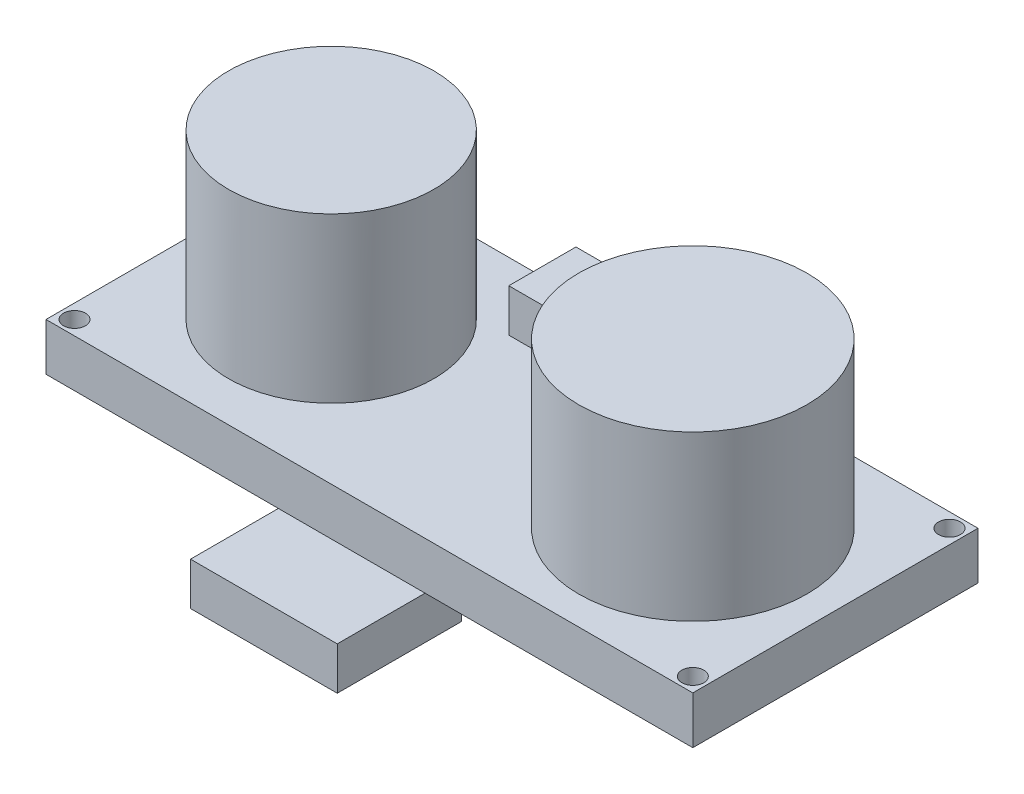
from build123d import *

# Parameters (mm, degrees)
SKETCH1_W           = 45.36
SKETCH1_H           = 20
BOSS_EXTRUDE1_DEPTH = 3.33
SKETCH2_R           = 8
SKETCH2_R_2         = 7.201770051
BOSS_EXTRUDE2_DEPTH = 11.5
SKETCH3_R           = 0.77
CUT_EXTRUDE1_DEPTH  = 11.5
SKETCH4_W           = 11
SKETCH4_H           = 4.71
BOSS_EXTRUDE3_DEPTH = 3
SKETCH5_W           = 10.29
SKETCH5_H           = 8.7
BOSS_EXTRUDE4_DEPTH = 3


with BuildPart() as part:
    # Sketch1 → Boss-Extrude1 (new body)
    with BuildSketch(Plane(origin=(0, 0, 0), x_dir=(1, 0, 0), z_dir=(0, 1, 0))):
        Rectangle(SKETCH1_W, SKETCH1_H)
    extrude(amount=BOSS_EXTRUDE1_DEPTH)

    # Sketch2 → Boss-Extrude2 (add)
    with BuildSketch(Plane(origin=(0, 3.33, 0), x_dir=(1, 0, 0), z_dir=(0, 1, 0))):
        with Locations(Location((12.68, 0, 0), (0, 0, 90))):
            Circle(SKETCH2_R)
        with Locations(Location((-12.68, 0, 0), (0, 0, 90))):
            Circle(SKETCH2_R_2)
    extrude(amount=BOSS_EXTRUDE2_DEPTH)

    # Sketch3 → Cut-Extrude1 (cut)
    with BuildSketch(Plane(origin=(0, 3.33, 0), x_dir=(1, 0, 0), z_dir=(0, 1, 0))):
        with Locations(Location((21.68, 9, 0), (0, 0, 270))):
            Circle(SKETCH3_R)
        with Locations(Location((21.68, -9, 0), (0, 0, 270))):
            Circle(SKETCH3_R)
        with Locations(Location((-21.68, -9, 0), (0, 0, 270))):
            Circle(SKETCH3_R)
        with Locations(Location((-21.68, 9, 0), (0, 0, 270))):
            Circle(SKETCH3_R)
    extrude(amount=-CUT_EXTRUDE1_DEPTH, mode=Mode.SUBTRACT)

    # Sketch4 → Boss-Extrude3 (add)
    with BuildSketch(Plane(origin=(0, 3.33, 0), x_dir=(1, 0, 0), z_dir=(0, 1, 0))):
        with Locations((0, 7.63)):
            Rectangle(SKETCH4_W, SKETCH4_H)
    extrude(amount=BOSS_EXTRUDE3_DEPTH)

    # Sketch5 → Boss-Extrude4 (add)
    with BuildSketch(Plane.XZ):
        with Locations((-1.239937646, 11.81)):
            Rectangle(SKETCH5_W, SKETCH5_H)
    extrude(amount=BOSS_EXTRUDE4_DEPTH)


solid = part.part
